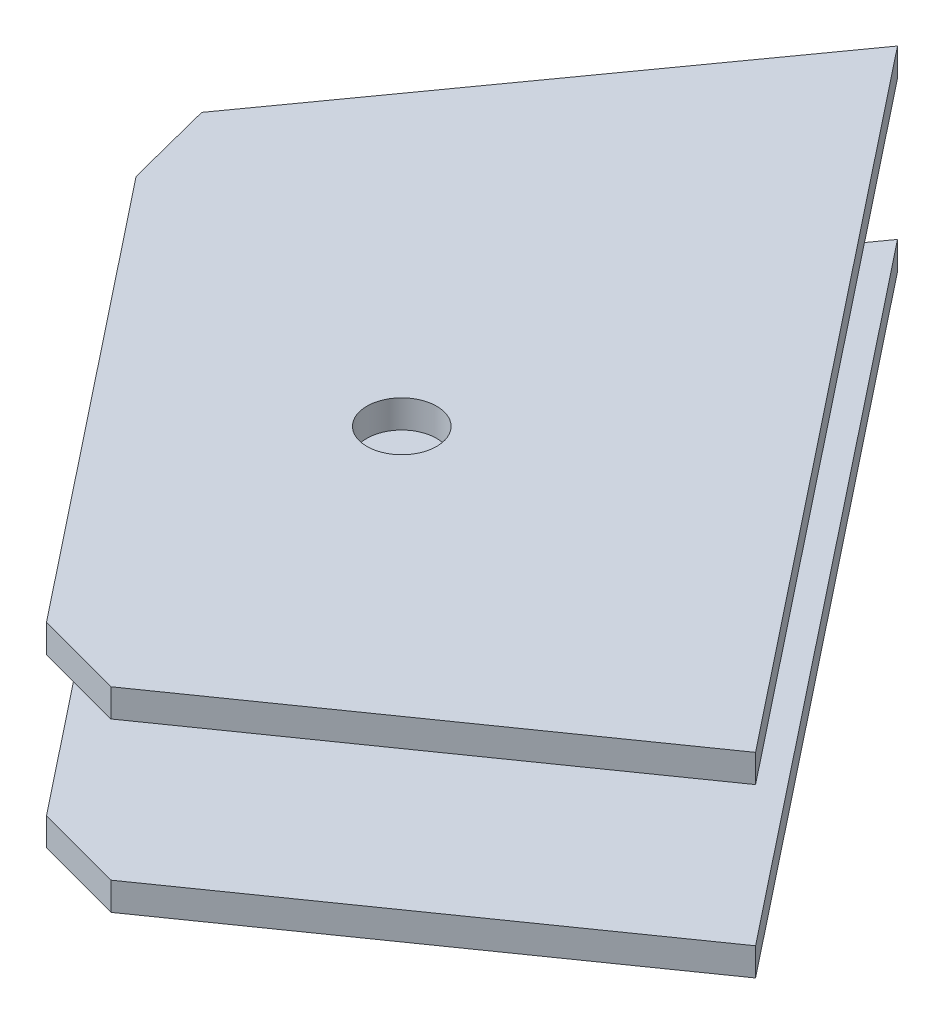
from build123d import *

# Parameters (mm, degrees)
SKETCH2_R           = 3.175
BOSS_EXTRUDE2_DEPTH = 2.54
SKETCH4_R           = 3.175
BOSS_EXTRUDE3_DEPTH = 2.54
SKETCH5_R           = 1.1303
CUT_EXTRUDE1_DEPTH  = 5.08


with BuildPart() as part:
    # Sketch2 → Boss-Extrude2 (new body)
    with BuildSketch(Plane(origin=(0, 6.35, 0), x_dir=(-1, 0, 0), z_dir=(0, 1, 0))):
        Polygon((0.713995358, 31.613572635), (31.777418825, -7.603548367), (33.836779239, -15.633002319), (7.412244786, -52.521880964), (-41.794398071, 9.600791031), (-7.292888746, 33.759010361), align=None)
        with Locations(Location((0, 0, 0), (0, 0, 90))):
            Circle(SKETCH2_R, mode=Mode.SUBTRACT)
    extrude(amount=BOSS_EXTRUDE2_DEPTH)


with BuildPart() as body_2:
    # Sketch4 → Boss-Extrude3 (new body)
    with BuildSketch(Plane(origin=(0, -6.35, 0), x_dir=(-1, 0, 0), z_dir=(0, 1, 0))):
        Polygon((0.713995358, 31.613572635), (31.777418825, -7.603548367), (33.836779239, -15.633002319), (7.412244786, -52.521880964), (-41.794398071, 9.600791031), (-7.292888746, 33.759010361), align=None)
        with Locations(Location((0, 0, 0), (0, 0, 90))):
            Circle(SKETCH4_R, mode=Mode.SUBTRACT)
    extrude(amount=-BOSS_EXTRUDE3_DEPTH)

    # Sketch5 → Cut-Extrude1 (cut)
    with BuildSketch(Plane.XZ.offset(8.89)):
        with Locations(Location((-4.350861658, 7.854263646, 0), (0, 0, 270))):
            Circle(SKETCH5_R)
        with Locations(Location((-9.826647811, 0.092215782, 0), (0, 0, 270))):
            Circle(SKETCH5_R)
        with Locations(Location((-7.168068721, -4.679147899, 0), (0, 0, 270))):
            Circle(SKETCH5_R)
    extrude(amount=-CUT_EXTRUDE1_DEPTH, mode=Mode.SUBTRACT)


solid = Compound([part.part, body_2.part])
